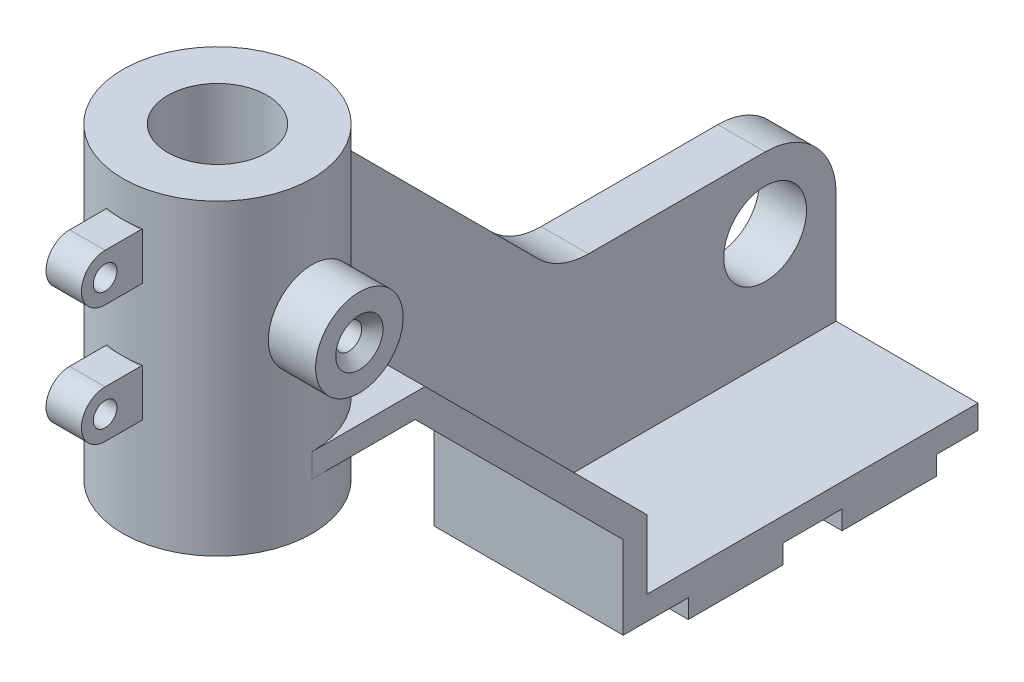
from build123d import *

# Parameters (mm, degrees)
SKETCH1_W                  = 40
SKETCH1_H                  = 2.522686521
BOSS_EXTRUDE1_DEPTH        = 80
BOSS_EXTRUDE2_DEPTH        = 20
FILLET1_R                  = 30
F_25_0_35_DIAMETER_HOLE1_D = 35
BOSS_EXTRUDE3_DEPTH        = 50
BOSS_EXTRUDE3_DEPTH_BACK   = 80
SKETCH3_R                  = 40
BOSS_EXTRUDE4_DEPTH        = 7.5
F_25_0_42_DIAMETER_HOLE1_D = 42
F_10_0_10_DIAMETER_HOLE1_D = 10
SKETCH7_R                  = 18.5
BOSS_EXTRUDE5_DEPTH        = 20


with BuildPart() as part:
    # Sketch1 → Boss-Extrude1 (new body)
    with BuildSketch(Plane(origin=(0, 0, 0), x_dir=(0, 0, -1), z_dir=(1, 0, 0))):
        Polygon((137.68936662, -61.464817383), (97.68936662, -61.464817383), (97.68936662, -69.464817383), (137.68936662, -69.464817383), (137.68936662, -66.026855296), align=None)
        Polygon((-13.668497756, 71.535182617), (-61.372704525, 71.535182617), (-61.372704525, 61.535182617), (-17.81063338, 61.535182617), (70.18936662, -26.464817383), (70.18936662, -61.464817383), (97.68936662, -61.464817383), (97.68936662, -58.942130862), (137.68936662, -58.942130862), (137.68936662, -61.464817383), (150.18936662, -61.464817383), (150.18936662, -51.464817383), (80.18936662, -51.464817383), (80.18936662, -22.32268176), align=None)
        Polygon((220.18936662, -51.464817383), (150.18936662, -51.464817383), (150.18936662, -61.464817383), (162.68936662, -61.464817383), (162.68936662, -58.942130862), (202.68936662, -58.942130862), (202.68936662, -61.464817383), (220.18936662, -61.464817383), align=None)
        with Locations((182.68936662, -60.203474123)):
            Rectangle(SKETCH1_W, SKETCH1_H)
        Polygon((202.68936662, -61.464817383), (162.68936662, -61.464817383), (162.68936662, -66.026855296), (162.68936662, -69.464817383), (202.68936662, -69.464817383), align=None)
        with Locations((117.68936662, -60.203474123)):
            Rectangle(SKETCH1_W, SKETCH1_H)
    extrude(amount=BOSS_EXTRUDE1_DEPTH)

    # Sketch1<5> → Boss-Extrude2 (add)
    with BuildSketch(Plane(origin=(0, 0, 0), x_dir=(0, 0, -1), z_dir=(1, 0, 0))):
        Polygon((-61.372704525, 121.535182617), (-61.372704525, 71.535182617), (-13.668497756, 71.535182617), (80.18936662, -22.32268176), (80.18936662, -51.464817383), (220.18936662, -51.464817383), (220.18936662, 25.535182617), (103.042180363, 25.535182617), (7.042180363, 121.535182617), align=None)
    extrude(amount=BOSS_EXTRUDE2_DEPTH)

    # Fillet1
    fillet1_edges = [part.edges().sort_by_distance(p)[0] for p in [
        (10, 121.535182617, -7.042180363),
        (10, 25.535182617, -220.18936662),
        (10, 25.535182617, -103.042180363),
    ]]
    fillet(fillet1_edges, radius=FILLET1_R)

    # Ø25.0 (35) Diameter Hole1 (through all)
    with Locations(Plane(origin=(20, -4.464817383, -190.18936662), x_dir=(0, 0, 1), z_dir=(1, 0, 0))):
        with Locations((0, 0)):
            Hole(F_25_0_35_DIAMETER_HOLE1_D / 2)

    # Sketch3 → Boss-Extrude3 (add, two sides: drawn at the far end of the back side and taken through both)
    with BuildSketch(Plane(origin=(0, 121.535182617, 0), x_dir=(1, 0, 0), z_dir=(0, 1, 0)).offset(-BOSS_EXTRUDE3_DEPTH_BACK)):
        with Locations(Location((40, -61.372704525, 0), (0, 0, 270))):
            Circle(SKETCH3_R)
    extrude(amount=BOSS_EXTRUDE3_DEPTH + BOSS_EXTRUDE3_DEPTH_BACK)

    # Sketch4 → Boss-Extrude4 (add, symmetric)
    with BuildSketch(Plane.ZY.offset(-40)):
        with BuildLine():
            Line((101.372704525, 156.535182617), (116.372704525, 156.535182617))
            ThreePointArc((116.372704525, 156.535182617), (126.372704525, 146.535182617), (116.372704525, 136.535182617))
            Line((116.372704525, 136.535182617), (101.372704525, 136.535182617))
            ThreePointArc((101.372704525, 136.535182617), (91.372704525, 146.535182617), (101.372704525, 156.535182617))
        make_face()
        with BuildLine():
            Line((101.372704525, 106.535182617), (116.372704525, 106.535182617))
            ThreePointArc((116.372704525, 106.535182617), (126.372704525, 96.535182617), (116.372704525, 86.535182617))
            Line((116.372704525, 86.535182617), (101.372704525, 86.535182617))
            ThreePointArc((101.372704525, 86.535182617), (91.372704525, 96.535182617), (101.372704525, 106.535182617))
        make_face()
    extrude(amount=BOSS_EXTRUDE4_DEPTH, both=True)

    # Ø25.0 (42) Diameter Hole1 (through all)
    with Locations(Plane(origin=(40, 171.535182617, 61.372704525), x_dir=(0, 0, 1), z_dir=(0, 1, 0))):
        with Locations((0, 0)):
            Hole(F_25_0_42_DIAMETER_HOLE1_D / 2)

    # Ø10.0 (10) Diameter Hole1 (through all)
    with Locations(Plane(origin=(32.5, 146.535182617, 116.372704525), x_dir=(0, 0, -1), z_dir=(-1, 0, 0))):
        with Locations((0, 0), (0, 50)):
            Hole(F_10_0_10_DIAMETER_HOLE1_D / 2)


with BuildPart() as body_2:
    # Sketch7 → Boss-Extrude5 (new body)
    with BuildSketch(Plane(origin=(80, 0, 0), x_dir=(0, 0, -1), z_dir=(1, 0, 0))):
        with Locations((-61.372704525, 121.535182617)):
            Circle(SKETCH7_R)
    extrude(amount=BOSS_EXTRUDE5_DEPTH)


with BuildPart() as csk_for_m10_flat_head_machine_screw1_tool:
    # Sketch8 → CSK for M10 Flat Head Machine Screw1 (revolve)
    with BuildSketch(Plane(origin=(100, 121.535182617, 61.372704525), x_dir=(0, 0, -1), z_dir=(0, 1, 0))):
        Polygon((0, 0), (0, 100), (5.5, 100), (5.5, 4.5), (10, 0), align=None)
    revolve(axis=Axis((106.35, 121.535182617, 61.372704525), (-1, 0, 0)))


with BuildPart() as part_1:
    add(part.part)

    # CSK for M10 Flat Head Machine Screw1: cut by csk_for_m10_flat_head_machine_screw1_tool
    add(csk_for_m10_flat_head_machine_screw1_tool.part, mode=Mode.SUBTRACT)


with BuildPart() as body_2_1:
    add(body_2.part)

    # CSK for M10 Flat Head Machine Screw1: cut by csk_for_m10_flat_head_machine_screw1_tool
    add(csk_for_m10_flat_head_machine_screw1_tool.part, mode=Mode.SUBTRACT)


solid = Compound([part_1.part, body_2_1.part])
